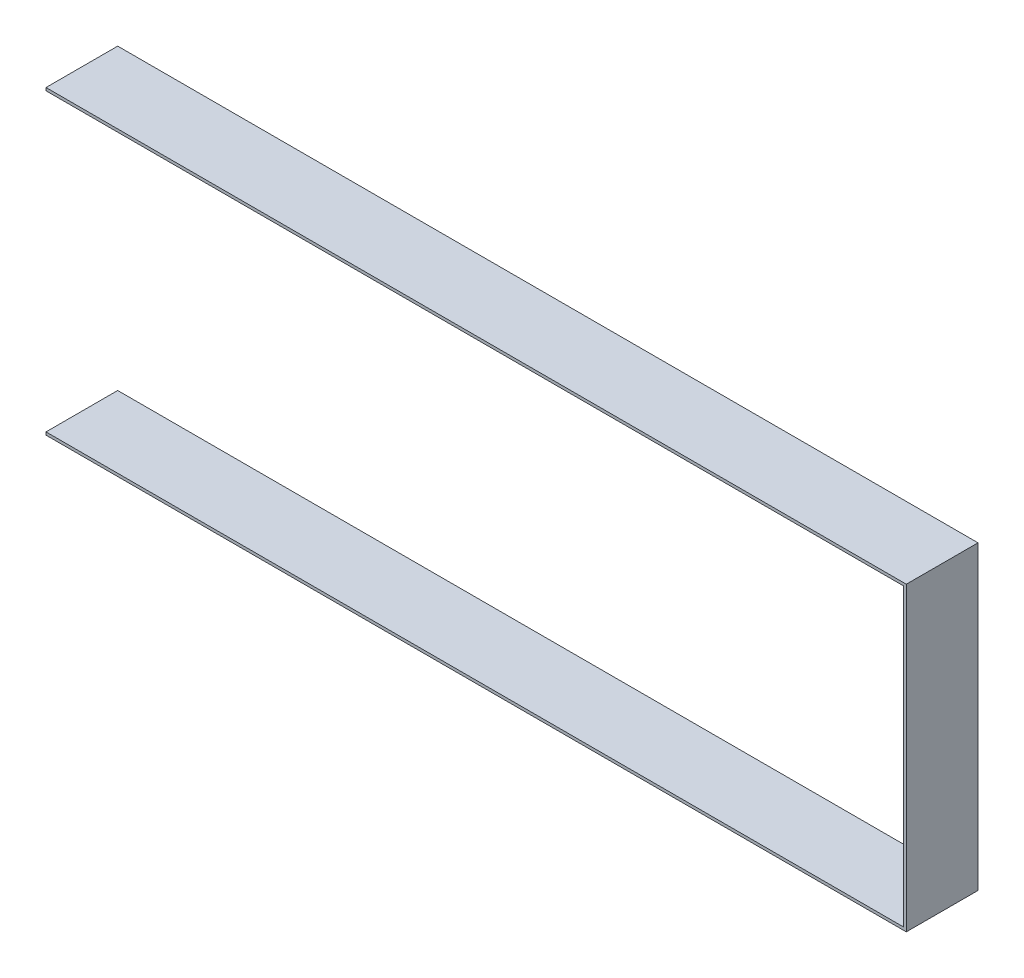
from build123d import *

# Parameters (mm, degrees)
BOSS_EXTRUDE1_DEPTH = 6.35


with BuildPart() as part:
    # Sketch2 → Boss-Extrude1 (new body)
    with BuildSketch(Plane.XY):
        Polygon((-2.074333333, 0), (74.125666667, 0), (74.125666667, 26.67), (-2.074333333, 26.67), (-2.074333333, 26.416), (73.871666667, 26.416), (73.871666667, 0.254), (-2.074333333, 0.254), align=None)
    extrude(amount=BOSS_EXTRUDE1_DEPTH)


solid = part.part
